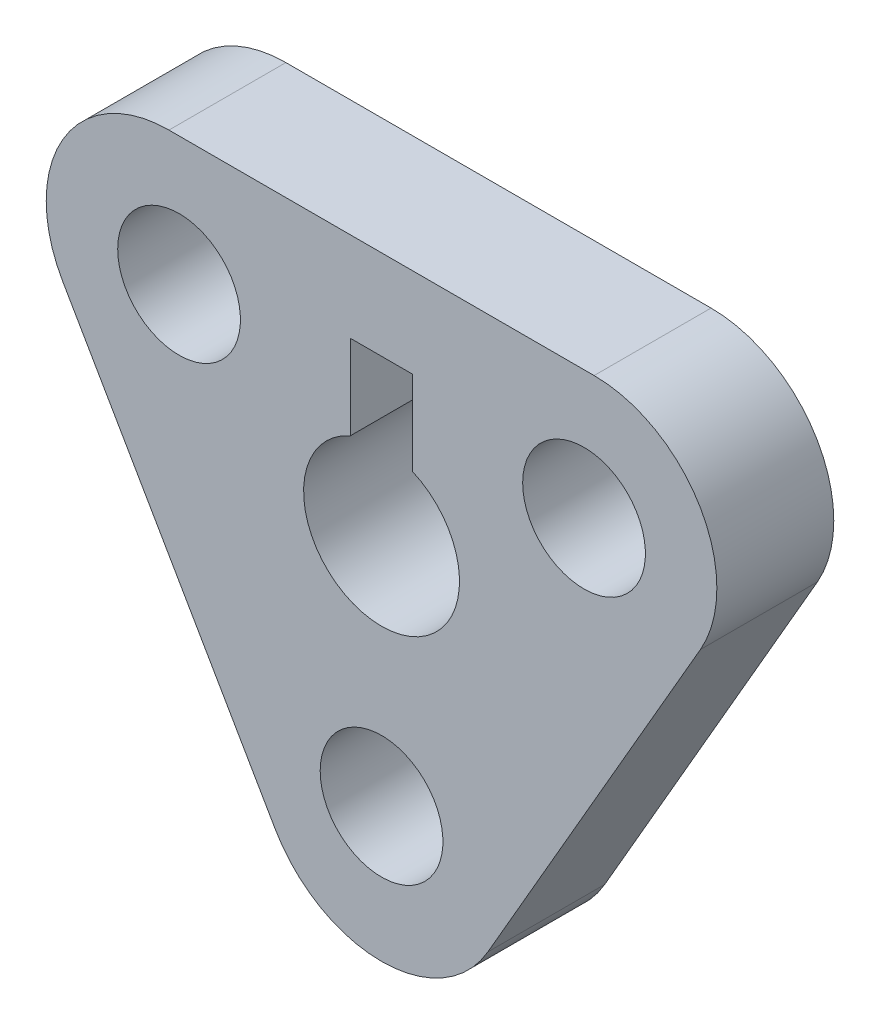
from build123d import *

# Parameters (mm, degrees)
SKETCH2_R           = 6.35
SKETCH2_R_2         = 5
BOSS_EXTRUDE1_DEPTH = 9.525
FILLET1_R           = 10
SKETCH3_W           = 5.08
SKETCH3_H           = 12.7
CUT_EXTRUDE1_DEPTH  = 42.678960958


with BuildPart() as part:
    # Sketch2 → Boss-Extrude1 (new body)
    with BuildSketch(Plane.XY):
        Polygon((-34.641016151, 20), (0, -40), (34.641016151, 20), align=None)
        with Locations(Location((0, 0, 0), (0, 0, 180))):
            Circle(SKETCH2_R, mode=Mode.SUBTRACT)
        with Locations(Location((-16.497783942, 9.525, 0), (0, 0, 180))):
            Circle(SKETCH2_R_2, mode=Mode.SUBTRACT)
        with Locations(Location((16.497783942, 9.525, 0), (0, 0, 180))):
            Circle(SKETCH2_R_2, mode=Mode.SUBTRACT)
        with Locations(Location((0, -19.05, 0), (0, 0, 180))):
            Circle(SKETCH2_R_2, mode=Mode.SUBTRACT)
    extrude(amount=BOSS_EXTRUDE1_DEPTH)

    # Fillet1
    fillet1_edges = [part.edges().sort_by_distance(p)[0] for p in [
        (34.641016151, 20, 4.7625),
        (0, -40, 4.7625),
        (-34.641016151, 20, 4.7625),
    ]]
    fillet(fillet1_edges, radius=FILLET1_R)

    # Sketch3 → Cut-Extrude1 (cut, through all)
    with BuildSketch(Plane.XY):
        with Locations((0, 6.35)):
            Rectangle(SKETCH3_W, SKETCH3_H)
    extrude(amount=CUT_EXTRUDE1_DEPTH, mode=Mode.SUBTRACT)


solid = part.part
